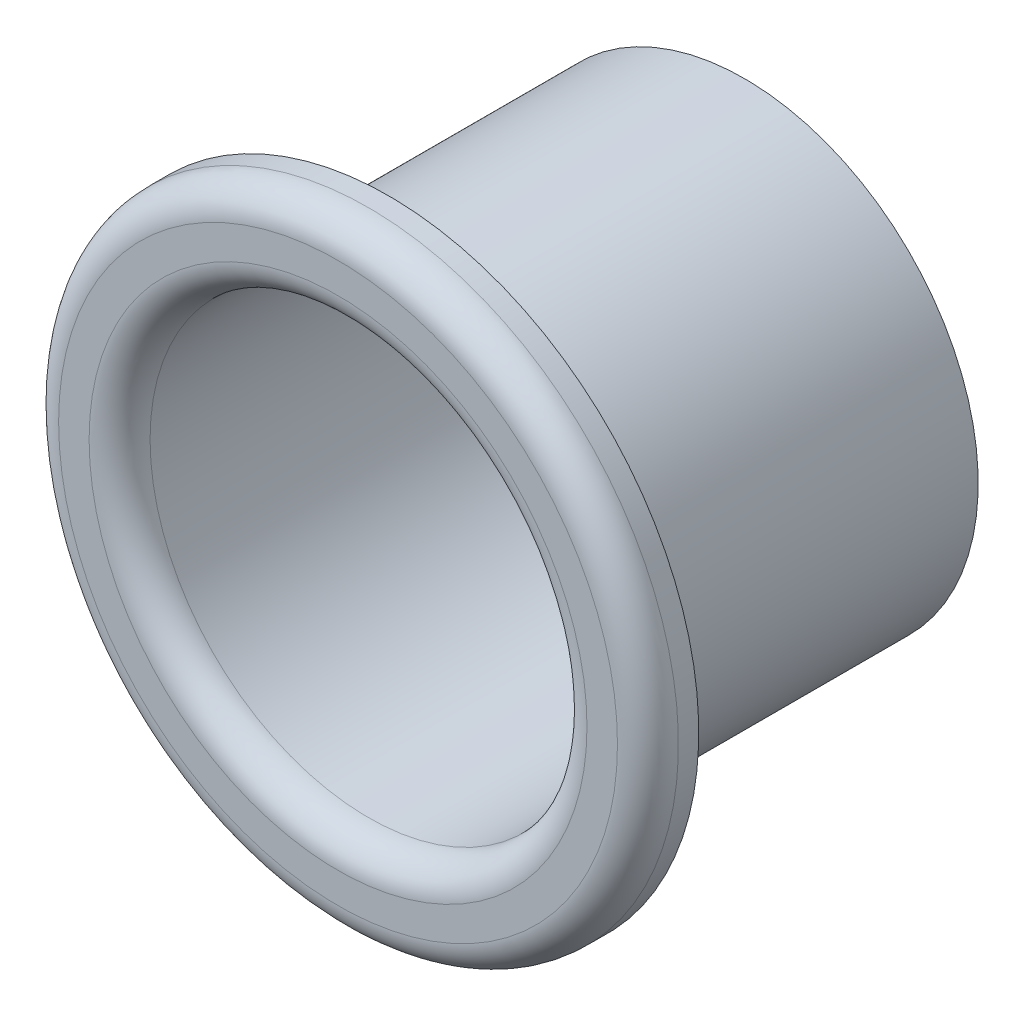
from build123d import *


with BuildPart() as part:
    # Esboço1 → Revolução1 (revolve)
    with BuildSketch(Plane(origin=(0, 0, 0), x_dir=(0, 0, -1), z_dir=(1, 0, 0)), mode=Mode.PRIVATE) as revolu_o1_sk:
        with BuildLine():
            Line((5, 30.5), (3, 30.5))
            ThreePointArc((3, 30.5), (0.878679656, 29.621320344), (0, 27.5))
            Line((0, 27.5), (0, 24.5))
            ThreePointArc((0, 24.5), (0.878679656, 22.378679656), (3, 21.5))
            Line((3, 21.5), (40, 21.5))
            Line((40, 21.5), (40, 23))
            Line((40, 23), (3, 23))
            ThreePointArc((3, 23), (1.939339828, 23.439339828), (1.5, 24.5))
            Line((1.5, 24.5), (1.5, 27.5))
            ThreePointArc((1.5, 27.5), (1.939339828, 28.560660172), (3, 29))
            Line((3, 29), (5, 29))
            Line((5, 29), (5, 30.5))
        make_face()
    revolve(revolu_o1_sk.sketch.rotate(Axis((0, 0, 0), (0, 0, 1)), 90), axis=Axis((0, 0, 0), (0, 0, 1)))


solid = part.part
